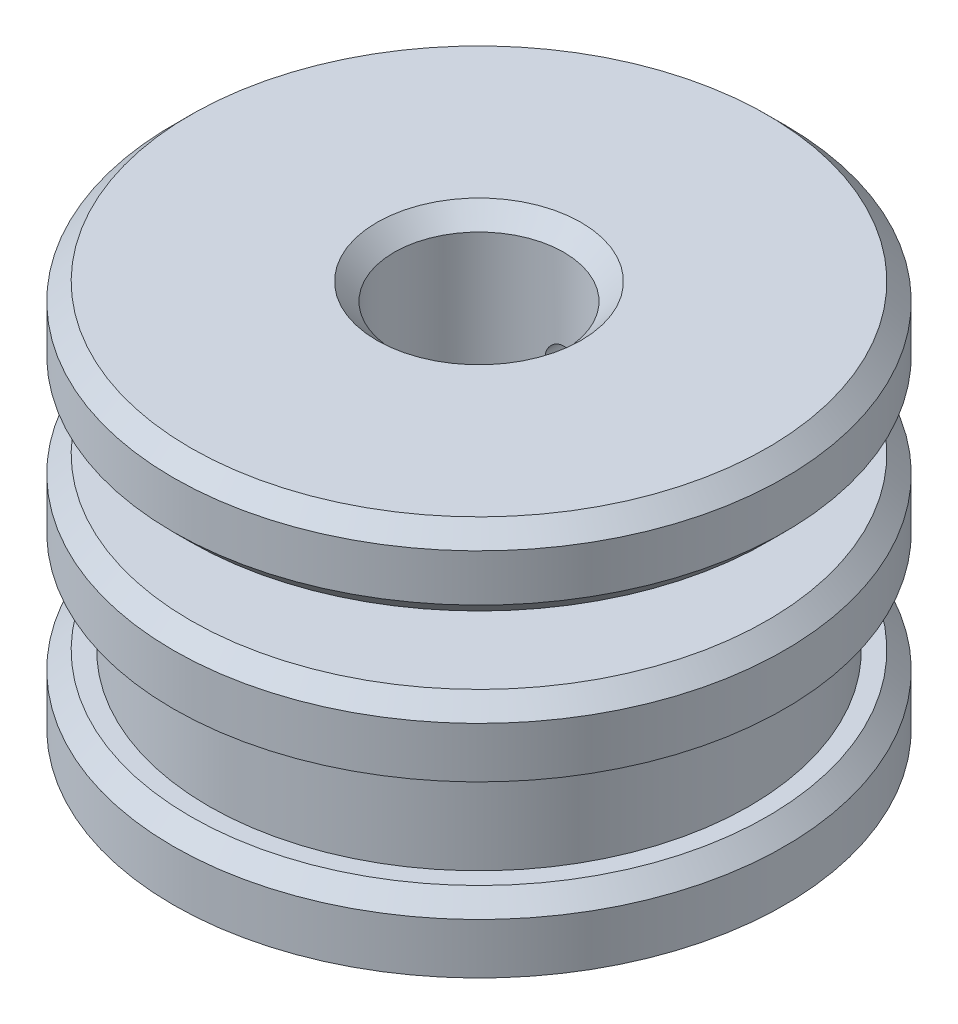
from build123d import *

# Parameters (mm, degrees)
SKETCH1_R           = 9
SKETCH1_R_2         = 2.35
BOSS_EXTRUDE1_DEPTH = 2
SKETCH2_R           = 7.9615
SKETCH2_R_2         = 1.1375
BOSS_EXTRUDE2_DEPTH = 1.5
SKETCH3_R           = 7.9615
SKETCH3_R_2         = 2.5
BOSS_EXTRUDE3_DEPTH = 1.5
SKETCH5_R           = 9
SKETCH5_R_2         = 2.5
BOSS_EXTRUDE4_DEPTH = 2
SKETCH6_R           = 5.1
SKETCH6_R_2         = 2.5
BOSS_EXTRUDE5_DEPTH = 2
SKETCH7_R           = 9
SKETCH7_R_2         = 2.5
BOSS_EXTRUDE6_DEPTH = 2.4
SKETCH8_R           = 0.5
CUT_EXTRUDE1_DEPTH  = 18.086837039
CHAMFER1_SIZE       = 0.508


with BuildPart() as part:
    # Sketch1 → Boss-Extrude1 (new body)
    with BuildSketch(Plane(origin=(0, 0, 0), x_dir=(1, 0, 0), z_dir=(0, 1, 0))):
        with Locations(Location((0, 0, 0), (0, 0, 270))):
            Circle(SKETCH1_R)
        with Locations(Location((0, 0, 0), (0, 0, 270))):
            Circle(SKETCH1_R_2, mode=Mode.SUBTRACT)
    extrude(amount=BOSS_EXTRUDE1_DEPTH)

    # Sketch2 → Boss-Extrude2 (add)
    with BuildSketch(Plane(origin=(0, 2, 0), x_dir=(1, 0, 0), z_dir=(0, 1, 0))):
        with Locations(Location((0, 0, 0), (0, 0, 270))):
            Circle(SKETCH2_R)
        with Locations(Location((0, 0, 0), (0, 0, 270))):
            Circle(SKETCH2_R_2, mode=Mode.SUBTRACT)
    extrude(amount=BOSS_EXTRUDE2_DEPTH)

    # Sketch3 → Boss-Extrude3 (add)
    with BuildSketch(Plane(origin=(0, 3.5, 0), x_dir=(1, 0, 0), z_dir=(0, 1, 0))):
        with Locations(Location((0, 0, 0), (0, 0, 270))):
            Circle(SKETCH3_R)
        with Locations(Location((0, 0, 0), (0, 0, 270))):
            Circle(SKETCH3_R_2, mode=Mode.SUBTRACT)
    extrude(amount=BOSS_EXTRUDE3_DEPTH)

    # Sketch5 → Boss-Extrude4 (add)
    with BuildSketch(Plane(origin=(0, 5, 0), x_dir=(1, 0, 0), z_dir=(0, 1, 0))):
        with Locations(Location((0, 0, 0), (0, 0, 270))):
            Circle(SKETCH5_R)
        with Locations(Location((0, 0, 0), (0, 0, 270))):
            Circle(SKETCH5_R_2, mode=Mode.SUBTRACT)
    extrude(amount=BOSS_EXTRUDE4_DEPTH)

    # Sketch6 → Boss-Extrude5 (add)
    with BuildSketch(Plane(origin=(0, 7, 0), x_dir=(1, 0, 0), z_dir=(0, 1, 0))):
        with Locations(Location((0, 0, 0), (0, 0, 270))):
            Circle(SKETCH6_R)
        with Locations(Location((0, 0, 0), (0, 0, 270))):
            Circle(SKETCH6_R_2, mode=Mode.SUBTRACT)
    extrude(amount=BOSS_EXTRUDE5_DEPTH)

    # Sketch7 → Boss-Extrude6 (add)
    with BuildSketch(Plane(origin=(0, 9, 0), x_dir=(1, 0, 0), z_dir=(0, 1, 0))):
        with Locations(Location((0, 0, 0), (0, 0, 270))):
            Circle(SKETCH7_R)
        with Locations(Location((0, 0, 0), (0, 0, 270))):
            Circle(SKETCH7_R_2, mode=Mode.SUBTRACT)
    extrude(amount=BOSS_EXTRUDE6_DEPTH)

    # Sketch8 → Cut-Extrude1 (cut, through all)
    with BuildSketch(Plane.XY):
        with Locations(Location((0, 8, 0), (0, 0, 90))):
            Circle(SKETCH8_R)
        with Locations(Location((0, 4, 0), (0, 0, 89.999999996))):
            Circle(SKETCH8_R)
    extrude(amount=-CUT_EXTRUDE1_DEPTH, mode=Mode.SUBTRACT)

    # Chamfer1
    chamfer1_edges = [part.edges().sort_by_distance(p)[0] for p in [
        (0, 7, -9),
        (0, 11.4, -9),
        (0, 9, -9),
        (0, 11.4, -2.5),
        (0, 2, -9),
    ]]
    chamfer(chamfer1_edges, length=CHAMFER1_SIZE)


solid = part.part
